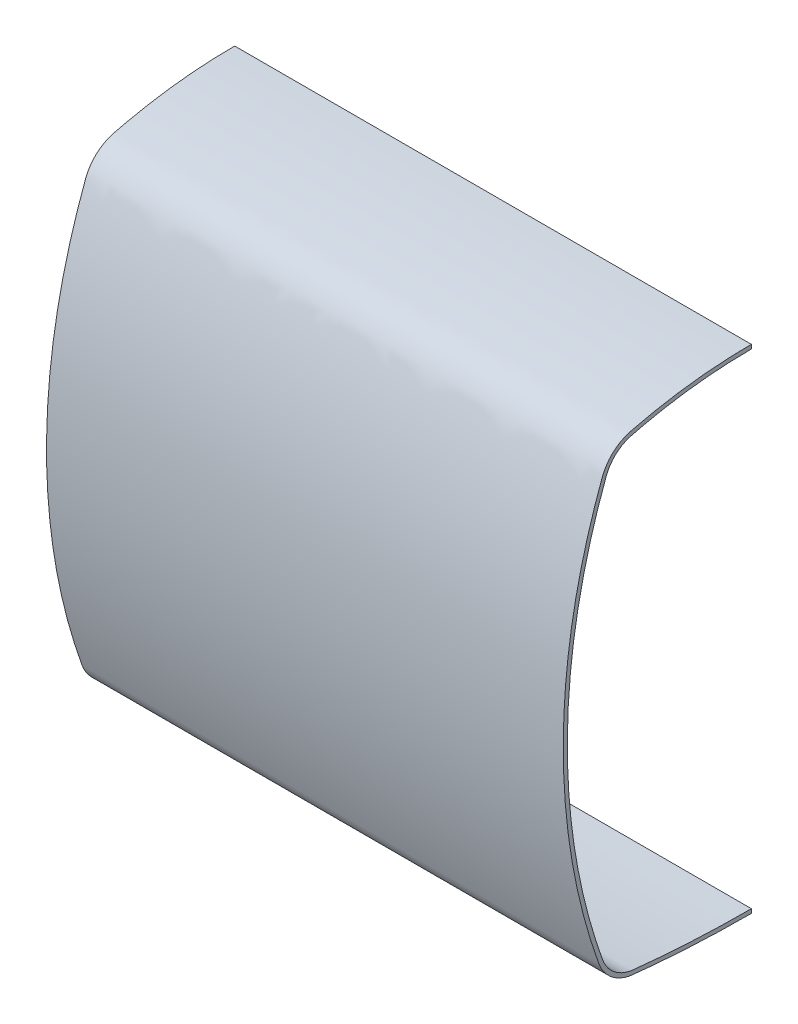
from build123d import *

# Parameters (mm, degrees)
BOSS_EXTRUDE1_DEPTH = 254


with BuildPart() as part:
    # Sketch4 → Boss-Extrude1 (new body)
    with BuildSketch(Plane.ZY.offset(245.21753429)):
        with BuildLine():
            Line((-67.500006187, 233.89227209), (-67.5, 231.89227209))
            add(Edge.make_bspline(
                [(-67.5, 231.89227209), (-47.72511642, 231.892333272), (-27.95023284, 229.467608245), (-5.327521602, 223.790399934), (-0.172030563, 220.775188), (2.985067404, 215.771662713), (28.720714796, 147.563954831), (29.367797285, 74.920918269), (4.549782804, 5.420416396), (2.595327017, 2.667355238), (-2.686171511, -1.595527822), (-5.962523964, -2.948930246), (-28.725761799, -5.333981655), (-48.085007287, -6.345420833), (-67.5, -6.345488263)],
                knots=[0, 0, 0, 0, 0.162724531, 0.162724531, 0.190497492, 0.210236448, 0.210236448, 0.785999019, 0.785999019, 0.813067495, 0.813067495, 0.841435541, 0.841435541, 1, 1, 1, 1], degree=3))
            Line((-67.5, -6.345488263), (-67.49999287, -8.345488263))
            add(Edge.make_bspline(
                [(-67.500006187, 233.89227209), (-52.18395554, 233.892319477), (-32.246175061, 232.013591616), (-12.657588436, 227.689731715), (-8.1266105, 226.552379867), (-8.109158968, 226.547979285), (-7.931912094, 226.503021068), (-6.744258688, 226.185774729), (-5.593667027, 225.760434933), (-2.719270156, 224.433391531), (-0.950559709, 223.251013954), (1.370013381, 221.100751364), (2.087762922, 220.32026293), (3.390598003, 218.655616767), (3.976679382, 217.771176316), (4.74733584, 216.381177199), (5.180159368, 215.522241117), (5.550490988, 214.63260913), (5.715182804, 214.197196928), (5.725098767, 214.17085686), (7.455415021, 209.581942579), (9.05997208, 204.989357667), (19.9636249, 171.165167662), (24.775383942, 140.859403623), (25.177054514, 80.182357659), (20.766944121, 49.810482345), (10.438644918, 16.263006952), (9.046857062, 12.073018614), (7.549692007, 7.879214289), (7.538907673, 7.848983457), (7.392584134, 7.442963641), (6.857291276, 6.086338249), (6.179315653, 4.800117053), (4.491069481, 2.129913678), (3.086784444, 0.531103863), (0.631432731, -1.497829072), (-0.238574634, -2.1068281), (-2.055769077, -3.176300365), (-3.004146601, -3.637774121), (-4.962187626, -4.406650334), (-6.476703091, -4.867760661), (-8.251236771, -5.184804829), (-8.992172494, -5.274784382), (-9.223349609, -5.29906682), (-9.23686374, -5.30048065), (-13.339274551, -5.730330997), (-32.713502597, -7.545094251), (-52.139953739, -8.345434916), (-67.49999287, -8.345488263)],
                knots=[0, 0, 0, 0, 0.125, 0.162719727, 0.162719727, 0.162841797, 0.162841797, 0.1640625, 0.171875, 0.171875, 0.1875, 0.1875, 0.1953125, 0.1953125, 0.203125, 0.203125, 0.20703125, 0.210205078, 0.210205078, 0.210449219, 0.210449219, 0.25, 0.25, 0.5, 0.5, 0.75, 0.75, 0.785888672, 0.785888672, 0.786132812, 0.786132812, 0.7890625, 0.796875, 0.796875, 0.8125, 0.8125, 0.8203125, 0.8203125, 0.828125, 0.828125, 0.8359375, 0.83984375, 0.841430664, 0.841430664, 0.841552734, 0.841552734, 0.875, 1, 1, 1, 1], degree=3))
        make_face()
    extrude(amount=-BOSS_EXTRUDE1_DEPTH)


solid = part.part
